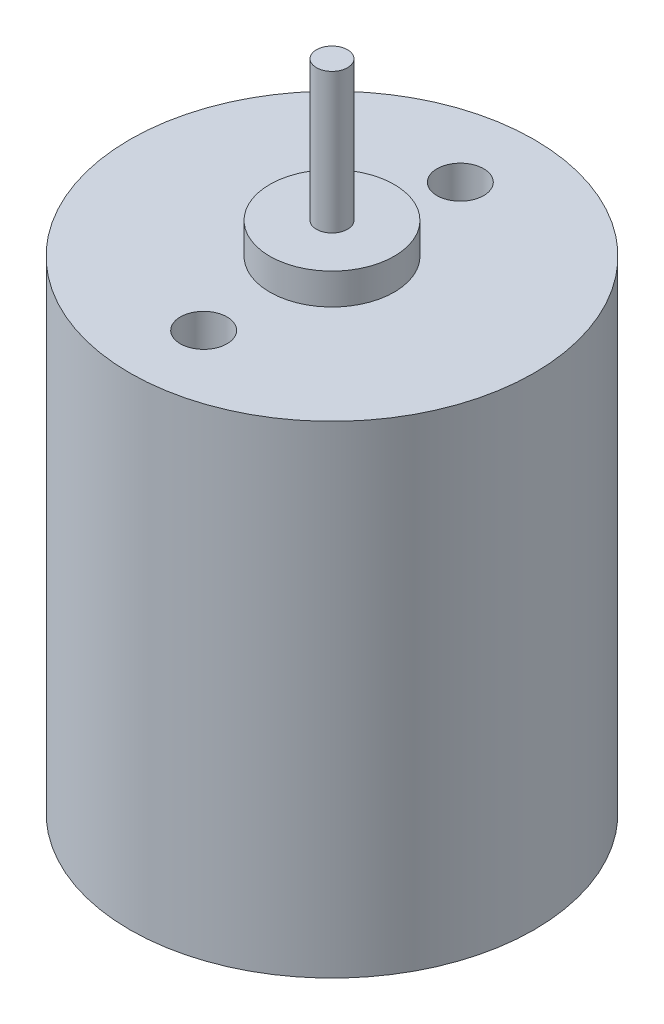
from build123d import *

# Parameters (mm, degrees)
SKETCH1_R           = 13
BOSS_EXTRUDE1_DEPTH = 31
SKETCH2_R           = 4
BOSS_EXTRUDE2_DEPTH = 2
SKETCH3_R           = 1
BOSS_EXTRUDE3_DEPTH = 9
SKETCH4_R           = 1.5
CUT_EXTRUDE1_DEPTH  = 5


with BuildPart() as part:
    # Sketch1 → Boss-Extrude1 (new body)
    with BuildSketch(Plane(origin=(0, 0, 0), x_dir=(1, 0, 0), z_dir=(0, 1, 0))):
        with Locations(Location((0, 0, 0), (0, 0, 270))):
            Circle(SKETCH1_R)
    extrude(amount=BOSS_EXTRUDE1_DEPTH)

    # Sketch2 → Boss-Extrude2 (add)
    with BuildSketch(Plane(origin=(0, 31, 0), x_dir=(1, 0, 0), z_dir=(0, 1, 0))):
        with Locations(Location((0, 0, 0), (0, 0, 270))):
            Circle(SKETCH2_R)
    extrude(amount=BOSS_EXTRUDE2_DEPTH)

    # Sketch3 → Boss-Extrude3 (add)
    with BuildSketch(Plane(origin=(0, 33, 0), x_dir=(1, 0, 0), z_dir=(0, 1, 0))):
        with Locations(Location((0, 0, 0), (0, 0, 270))):
            Circle(SKETCH3_R)
    extrude(amount=BOSS_EXTRUDE3_DEPTH)

    # Sketch4 → Cut-Extrude1 (cut)
    with BuildSketch(Plane(origin=(0, 31, 0), x_dir=(1, 0, 0), z_dir=(0, 1, 0))):
        with Locations(Location((0, -8.25, 0), (0, 0, 270))):
            Circle(SKETCH4_R)
        with Locations(Location((0, 8.25, 0), (0, 0, 270))):
            Circle(SKETCH4_R)
    extrude(amount=-CUT_EXTRUDE1_DEPTH, mode=Mode.SUBTRACT)


solid = part.part
